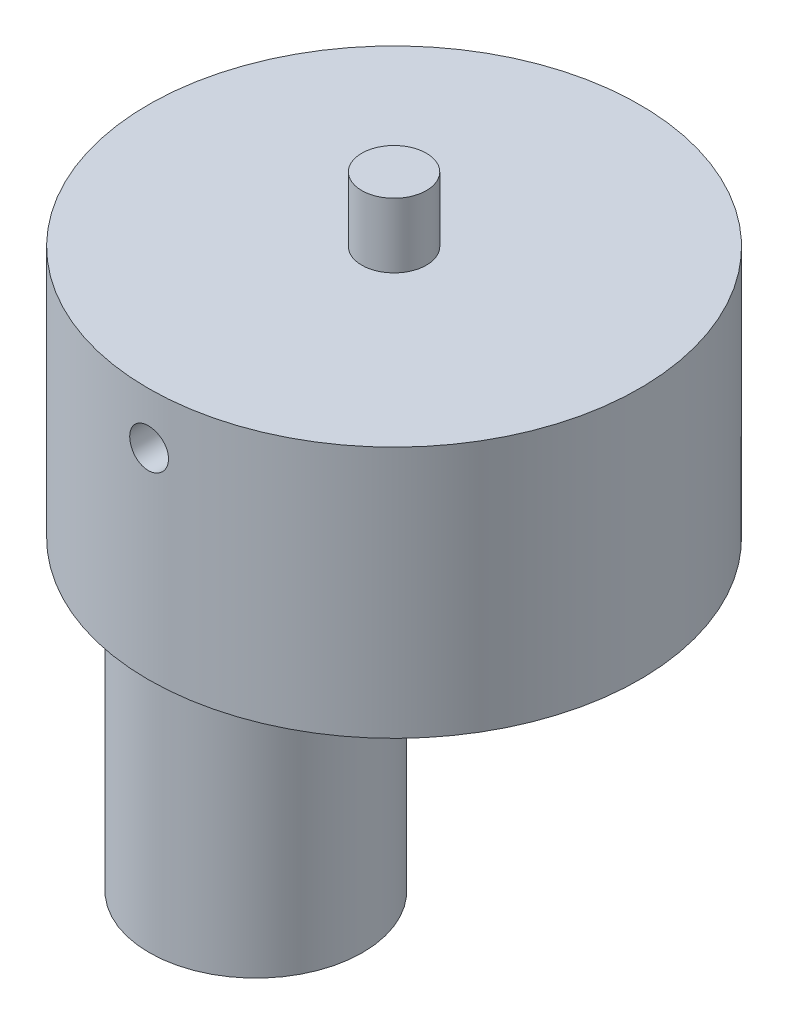
from build123d import *

# Parameters (mm, degrees)
SKETCH_1_R         = 38
EXTRUDE_1_DEPTH    = 39
SKETCH_2_R         = 5
EXTRUDE_2_DEPTH    = 10
SKETCH_6_R         = 16.5
EXTRUDE_6_DEPTH    = 58
SKETCH1_R          = 3
CUT_EXTRUDE1_DEPTH = 50


with BuildPart() as part:
    # Эскиз1 → Вытянуть1 (new body)
    with BuildSketch(Plane(origin=(0, 0, 0), x_dir=(1, 0, 0), z_dir=(0, 1, 0))):
        with Locations(Location((0, 0, 0), (0, 0, 270))):
            Circle(SKETCH_1_R)
    extrude(amount=EXTRUDE_1_DEPTH)

    # Эскиз2 → Вытянуть2 (add)
    with BuildSketch(Plane(origin=(0, 39, 0), x_dir=(1, 0, 0), z_dir=(0, 1, 0))):
        with Locations(Location((0, 0, 0), (0, 0, 270))):
            Circle(SKETCH_2_R)
    extrude(amount=EXTRUDE_2_DEPTH)

    # Эскиз6 → Вытянуть6 (add)
    with BuildSketch(Plane.XZ):
        with Locations(Location((-21.372740523, 0, 0), (0, 0, 90))):
            Circle(SKETCH_6_R)
    extrude(amount=EXTRUDE_6_DEPTH)

    # Sketch1 → Cut-Extrude1 (cut, symmetric)
    with BuildSketch(Plane.XY):
        with Locations((0, 31)):
            Circle(SKETCH1_R)
    extrude(amount=CUT_EXTRUDE1_DEPTH, both=True, mode=Mode.SUBTRACT)


solid = part.part
